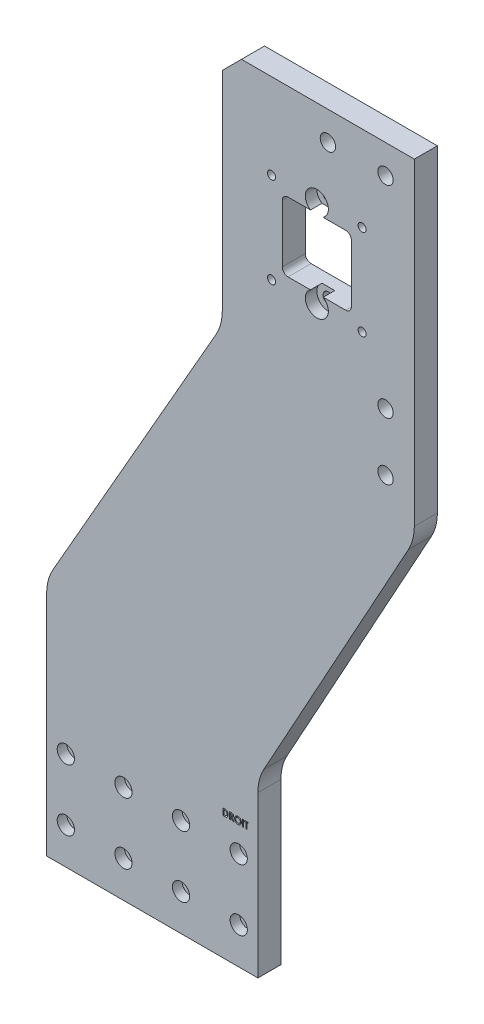
from build123d import *

# Parameters (mm, degrees)
ESQUISSE1_R             = 2.5
ESQUISSE1_R_2           = 2.1
ESQUISSE1_R_3           = 4
ESQUISSE1_R_4           = 2.75
BOSS_EXTRU_1_DEPTH      = 12
ESQUISSE2_R             = 4.5
ENL_V_MAT_EXTRU_1_DEPTH = 5
ESQUISSE3_W             = 0.628205128
ESQUISSE3_H             = 3.5
ENL_V_MAT_EXTRU_2_DEPTH = 1
ESQUISSE6_R             = 2.5
ENL_V_MAT_EXTRU_5_DEPTH = 10
ESQUISSE8_R             = 6
ENL_V_MAT_EXTRU_6_DEPTH = 6


with BuildPart() as part:
    # Esquisse1 → Boss.-Extru.1 (new body)
    with BuildSketch(Plane.XY):
        with BuildLine():
            Line((0, 0), (110, 0))
            Line((110, 0), (110, 83.574198108))
            ThreePointArc((110, 83.574198108), (110.787029848, 89.797708085), (113.098566114, 95.629371012))
            Line((113.098566114, 95.629371012), (188.36484852, 232.370628988))
            ThreePointArc((188.36484852, 232.370628988), (190.676384786, 238.202291915), (191.463414634, 244.425801892))
            Line((191.463414634, 244.425801892), (191.463414634, 410))
            Line((191.463414634, 410), (101.463414634, 410))
            Line((101.463414634, 410), (91.463414634, 400))
            Line((91.463414634, 400), (91.463414634, 291.641307553))
            ThreePointArc((91.463414634, 291.641307553), (90.625379122, 285.222626063), (88.167456868, 279.234271215))
            Line((88.167456868, 279.234271215), (3.295957766, 130.765728785))
            ThreePointArc((3.295957766, 130.765728785), (0.838035512, 124.777373937), (0, 118.358692447))
            Line((0, 118.358692447), (0, 0))
        make_face()
        with Locations((40, 51)):
            Circle(ESQUISSE1_R, mode=Mode.SUBTRACT)
        with Locations((40, 19)):
            Circle(ESQUISSE1_R, mode=Mode.SUBTRACT)
        with Locations((164.263414634, 318.43)):
            Circle(ESQUISSE1_R_2, mode=Mode.SUBTRACT)
        with Locations(Location((117.123414634, 318.43, 0), (0, 0, 180))):
            Circle(ESQUISSE1_R_2, mode=Mode.SUBTRACT)
        with Locations(Location((164.263414634, 365.57, 0), (0, 0, 180))):
            Circle(ESQUISSE1_R_2, mode=Mode.SUBTRACT)
        with Locations((117.123414634, 365.57)):
            Circle(ESQUISSE1_R_2, mode=Mode.SUBTRACT)
        with Locations((10, 51)):
            Circle(ESQUISSE1_R, mode=Mode.SUBTRACT)
        with Locations((10, 19)):
            Circle(ESQUISSE1_R, mode=Mode.SUBTRACT)
        with Locations(Location((100, 51, 0), (0, 0, 180))):
            Circle(ESQUISSE1_R, mode=Mode.SUBTRACT)
        with Locations(Location((100, 19, 0), (0, 0, 180))):
            Circle(ESQUISSE1_R, mode=Mode.SUBTRACT)
        with Locations(Location((70, 19, 0), (0, 0, 180))):
            Circle(ESQUISSE1_R, mode=Mode.SUBTRACT)
        with Locations(Location((70, 51, 0), (0, 0, 180))):
            Circle(ESQUISSE1_R, mode=Mode.SUBTRACT)
        with Locations((176.463414634, 395)):
            Circle(ESQUISSE1_R_3, mode=Mode.SUBTRACT)
        with Locations((146.463414634, 395)):
            Circle(ESQUISSE1_R_3, mode=Mode.SUBTRACT)
        with Locations((176.463414634, 290)):
            Circle(ESQUISSE1_R_3, mode=Mode.SUBTRACT)
        with Locations((176.463414634, 260)):
            Circle(ESQUISSE1_R_3, mode=Mode.SUBTRACT)
        with Locations((140.693414634, 319)):
            Circle(ESQUISSE1_R_4, mode=Mode.SUBTRACT)
        with Locations(Location((140.693414634, 365, 0), (0, 0, 180))):
            Circle(ESQUISSE1_R_4, mode=Mode.SUBTRACT)
        with BuildLine():
            Line((155.693414634, 360), (125.693414634, 360))
            ThreePointArc((125.693414634, 360), (123.572094291, 359.121320344), (122.693414634, 357))
            Line((122.693414634, 357), (122.693414634, 327))
            ThreePointArc((122.693414634, 327), (123.572094291, 324.878679656), (125.693414634, 324))
            Line((125.693414634, 324), (155.693414634, 324))
            ThreePointArc((155.693414634, 324), (157.814734978, 324.878679656), (158.693414634, 327))
            Line((158.693414634, 327), (158.693414634, 357))
            ThreePointArc((158.693414634, 357), (157.814734978, 359.121320344), (155.693414634, 360))
        make_face(mode=Mode.SUBTRACT)
    extrude(amount=BOSS_EXTRU_1_DEPTH)

    # Esquisse2 → Enlèv. mat.-Extru.1 (cut)
    with BuildSketch(Plane.XY.offset(12)):
        with Locations((10, 19)):
            Circle(ESQUISSE2_R)
        with Locations((40, 19)):
            Circle(ESQUISSE2_R)
        with Locations((70, 19)):
            Circle(ESQUISSE2_R)
        with Locations((100, 19)):
            Circle(ESQUISSE2_R)
        with Locations((40, 51)):
            Circle(ESQUISSE2_R)
        with Locations((70, 51)):
            Circle(ESQUISSE2_R)
        with Locations((100, 51)):
            Circle(ESQUISSE2_R)
        with Locations((10, 51)):
            Circle(ESQUISSE2_R)
    extrude(amount=-ENL_V_MAT_EXTRU_1_DEPTH, mode=Mode.SUBTRACT)

    # Esquisse3 → Enlèv. mat.-Extru.2 (cut)
    # profile 1 of 5: a face of its own
    with BuildSketch(Plane.XY.offset(12)):
        with BuildLine():
            Line((91.772253802, 67.649572565), (92.563820309, 67.649572565))
            add(Edge.make_bspline(
                [(92.563820309, 67.649572565), (92.625532023, 67.649141179), (92.744821463, 67.648307305), (92.917648263, 67.63891155), (93.078355194, 67.624461546), (93.227045852, 67.604582947), (93.363415396, 67.578278117), (93.48728798, 67.545283863), (93.599079351, 67.507197486), (93.700015278, 67.462381135), (93.792160072, 67.410129721), (93.879654494, 67.35192584), (93.962326751, 67.285637315), (94.041337018, 67.212542983), (94.115665651, 67.131305606), (94.186550488, 67.043270769), (94.252255946, 66.947161845), (94.314768159, 66.845283224), (94.371302137, 66.737203154), (94.420613186, 66.623841589), (94.46192135, 66.505928054), (94.495486372, 66.383336883), (94.522241569, 66.256475042), (94.540961641, 66.125086535), (94.552534576, 65.989293007), (94.553708554, 65.897259065), (94.554305085, 65.850494039)],
                knots=[0, 0, 0, 0, 1.44355588, 2.790409838, 4.047694926, 5.217575253, 6.298404546, 7.294384826, 8.214239204, 9.058592145, 9.873746385, 10.689560431, 11.514393297, 12.350027578, 13.205127629, 14.088021785, 14.991911688, 15.926770944, 16.882954281, 17.842803888, 18.816321264, 19.80318086, 20.814351908, 21.847355356, 22.906180909, 24, 24, 24, 24], degree=3))
            add(Edge.make_bspline(
                [(94.554305085, 65.850494039), (94.552743045, 65.784505544), (94.549668078, 65.654603328), (94.523766274, 65.463973322), (94.481874287, 65.281235449), (94.422970349, 65.107819154), (94.349945234, 64.945268735), (94.262708557, 64.796450702), (94.16253941, 64.662163832), (94.050604771, 64.543076766), (93.929406818, 64.440719819), (93.803457705, 64.353058584), (93.671530459, 64.283930385), (93.555284117, 64.24009277), (93.454484036, 64.212829566), (93.365982656, 64.19671675), (93.265454118, 64.181940326), (93.151961081, 64.170521423), (93.026001415, 64.160338568), (92.887073042, 64.154805601), (92.735625773, 64.150208527), (92.630431325, 64.149790107), (92.575739379, 64.149572565)],
                knots=[0, 0, 0, 0, 1.315458931, 2.589557908, 3.828601765, 5.048913369, 6.235739168, 7.376350998, 8.481830359, 9.569842114, 10.627874879, 11.640079404, 12.624025415, 13.590060155, 14.111227486, 14.704434459, 15.382649715, 16.137166398, 16.978595427, 17.902333227, 18.909396075, 20, 20, 20, 20], degree=3))
            Line((92.575739379, 64.149572565), (91.772253802, 64.149572565))
            Line((91.772253802, 64.149572565), (91.772253802, 67.649572565))
        make_face()
        with BuildLine():
            Line((92.400458931, 67.021367437), (92.400458931, 64.777777693))
            Line((92.400458931, 64.777777693), (92.728583931, 64.777777693))
            add(Edge.make_bspline(
                [(92.728583931, 64.777777693), (92.767625766, 64.777849234), (92.842716214, 64.777986831), (92.951129822, 64.784540684), (93.051384921, 64.791118946), (93.143205531, 64.803604707), (93.227259894, 64.817512966), (93.302393324, 64.836868214), (93.370154647, 64.857199261), (93.429716171, 64.883083204), (93.484269674, 64.912217305), (93.534779987, 64.946351282), (93.58353658, 64.984255775), (93.629627911, 65.027045611), (93.673228423, 65.074154171), (93.714080148, 65.125824186), (93.75272835, 65.181898007), (93.788181, 65.242672111), (93.820577823, 65.307504711), (93.849317434, 65.375767807), (93.873146813, 65.448029885), (93.892952334, 65.523614484), (93.907105624, 65.603179655), (93.918814772, 65.686136068), (93.92485118, 65.77281239), (93.925679639, 65.831789857), (93.926099956, 65.861711988)],
                knots=[0, 0, 0, 0, 1.50275155, 2.890291501, 4.180787663, 5.369391935, 6.45668281, 7.458360028, 8.354766181, 9.177074746, 9.954075863, 10.732690366, 11.5210699, 12.329727389, 13.151100085, 13.990027547, 14.863562427, 15.770965086, 16.696477834, 17.652329173, 18.619756807, 19.62365428, 20.657822005, 21.729286259, 22.847956731, 24, 24, 24, 24], degree=3))
            add(Edge.make_bspline(
                [(93.926099956, 65.861711988), (93.925262826, 65.907564825), (93.923630488, 65.996974304), (93.907888569, 66.127201161), (93.882263727, 66.249829256), (93.845699548, 66.364403484), (93.799609266, 66.471245856), (93.741916534, 66.569451194), (93.675104226, 66.66066921), (93.622270875, 66.714180625), (93.595871591, 66.740918719)],
                knots=[0, 0, 0, 0, 1.13821349, 2.219428113, 3.251817212, 4.244760574, 5.201143372, 6.134805572, 7.068016741, 8, 8, 8, 8], degree=3))
            add(Edge.make_bspline(
                [(93.595871591, 66.740918719), (93.569839397, 66.763703189), (93.516671588, 66.81023789), (93.423326387, 66.865998362), (93.320464811, 66.914989402), (93.205733694, 66.953833833), (93.080241861, 66.984553665), (92.943241882, 67.005740383), (92.79546742, 67.019354742), (92.693092716, 67.020682165), (92.640242585, 67.021367437)],
                knots=[0, 0, 0, 0, 0.813307809, 1.661089106, 2.549956539, 3.493439533, 4.508053171, 5.589449661, 6.755572447, 8, 8, 8, 8], degree=3))
            Line((92.640242585, 67.021367437), (92.400458931, 67.021367437))
        make_face(mode=Mode.SUBTRACT)
    # profile 2 of 5: a face of its own
    with BuildSketch(Plane.XY.offset(12)):
        with BuildLine():
            Line((95.182510213, 67.649572565), (95.914481367, 67.649572565))
            add(Edge.make_bspline(
                [(95.914481367, 67.649572565), (95.962864437, 67.649400833), (96.05591871, 67.649070543), (96.19009789, 67.643859454), (96.313359919, 67.636607795), (96.425887298, 67.625541571), (96.527631886, 67.610869095), (96.618695655, 67.593572674), (96.699075944, 67.573859694), (96.769450648, 67.549295766), (96.832960338, 67.521588028), (96.892160199, 67.489751329), (96.948356268, 67.45414018), (97.001172934, 67.413817556), (97.051069187, 67.369508851), (97.098139159, 67.321169464), (97.141717708, 67.268389497), (97.181534993, 67.211502452), (97.217825244, 67.151658585), (97.249898214, 67.08877573), (97.275980006, 67.022810157), (97.299026066, 66.95471521), (97.315625396, 66.883517459), (97.327169987, 66.809910026), (97.335622486, 66.733633805), (97.336108464, 66.681815127), (97.336356367, 66.65538186)],
                knots=[0, 0, 0, 0, 1.749336639, 3.364467119, 4.854658419, 6.213483162, 7.451590619, 8.570285859, 9.5643256, 10.440900261, 11.26203566, 12.067320669, 12.869050712, 13.665104639, 14.467235401, 15.27997916, 16.102287765, 16.939272006, 17.78853747, 18.631303466, 19.488103222, 20.351255419, 21.228522269, 22.127379805, 23.044756219, 24, 24, 24, 24], degree=3))
            add(Edge.make_bspline(
                [(97.336356367, 66.65538186), (97.335712404, 66.627791601), (97.334449712, 66.573692133), (97.327648163, 66.494224426), (97.315217069, 66.418195282), (97.296388369, 66.345827306), (97.274747223, 66.276219794), (97.245970051, 66.210657047), (97.213492167, 66.148185551), (97.174919134, 66.089688988), (97.132587114, 66.033868034), (97.083355866, 65.982861395), (97.030414818, 65.933927659), (96.970787961, 65.890131868), (96.907103701, 65.848512709), (96.838096701, 65.810794668), (96.764217323, 65.776029599), (96.712276461, 65.756642196), (96.685715341, 65.746728014)],
                knots=[0, 0, 0, 0, 1.099860209, 2.156625411, 3.176576793, 4.16617041, 5.135385252, 6.078461593, 7.016046972, 7.938469504, 8.868247731, 9.803980173, 10.76021508, 11.73834243, 12.748633912, 13.790971185, 14.870363756, 16, 16, 16, 16], degree=3))
            Line((96.685715341, 65.746728014), (97.493407649, 64.149572565))
            Line((97.493407649, 64.149572565), (96.795090341, 64.149572565))
            Line((96.795090341, 64.149572565), (96.023856367, 65.67521359))
            Line((96.023856367, 65.67521359), (95.810715341, 65.67521359))
            Line((95.810715341, 65.67521359), (95.810715341, 64.149572565))
            Line((95.810715341, 64.149572565), (95.182510213, 64.149572565))
            Line((95.182510213, 64.149572565), (95.182510213, 67.649572565))
        make_face()
        with BuildLine():
            Line((95.810715341, 66.303418719), (96.055406847, 66.303418719))
            add(Edge.make_bspline(
                [(96.055406847, 66.303418719), (96.085322418, 66.303755648), (96.142604308, 66.304400795), (96.224983189, 66.307393255), (96.299802859, 66.314603605), (96.367384619, 66.323713612), (96.428068535, 66.334232431), (96.481313327, 66.349306537), (96.527939417, 66.365458823), (96.567394283, 66.385531925), (96.601103614, 66.408359396), (96.630209463, 66.43429197), (96.654284174, 66.464305623), (96.674098889, 66.497584712), (96.689512583, 66.534423583), (96.700763399, 66.57441783), (96.707050942, 66.618023037), (96.707774345, 66.648116567), (96.708151238, 66.663795321)],
                knots=[0, 0, 0, 0, 1.688639943, 3.233382647, 4.650958383, 5.928841754, 7.082724185, 8.122798841, 9.049171256, 9.863274652, 10.613301712, 11.341792392, 12.054588806, 12.776240173, 13.521029143, 14.301969904, 15.115324896, 16, 16, 16, 16], degree=3))
            add(Edge.make_bspline(
                [(96.708151238, 66.663795321), (96.707438686, 66.682344432), (96.70603901, 66.718780724), (96.692149873, 66.771236207), (96.670041366, 66.819787346), (96.639736659, 66.864214775), (96.60157182, 66.903162925), (96.557774656, 66.93749603), (96.507399919, 66.964644081), (96.460756703, 66.982550646), (96.418322279, 66.993264328), (96.38002655, 67.00124807), (96.335679865, 67.006906376), (96.285248746, 67.012908018), (96.228861742, 67.016799779), (96.16621151, 67.019639988), (96.097477983, 67.020802058), (96.049564186, 67.021173551), (96.024557488, 67.021367437)],
                knots=[0, 0, 0, 0, 1.020303359, 2.004196876, 2.966617323, 3.9489082, 4.950758222, 5.960522915, 7.003732012, 8.091992268, 8.70421221, 9.413913587, 10.24622431, 11.166358409, 12.212345909, 13.359657661, 14.621978493, 16, 16, 16, 16], degree=3))
            Line((96.024557488, 67.021367437), (95.810715341, 67.021367437))
            Line((95.810715341, 67.021367437), (95.810715341, 66.303418719))
        make_face(mode=Mode.SUBTRACT)
    # profile 3 of 5: a face of its own
    with BuildSketch(Plane.XY.offset(12)):
        with BuildLine():
            add(Edge.make_bspline(
                [(99.65426502, 67.739316155), (99.71511681, 67.737740593), (99.835252025, 67.734630077), (100.011927574, 67.7087015), (100.182187133, 67.6664546), (100.34595371, 67.607728354), (100.502817254, 67.530932156), (100.653331074, 67.43824323), (100.796956037, 67.327912126), (100.932220389, 67.202512688), (101.057229046, 67.066146274), (101.16554912, 66.919323586), (101.257920506, 66.765848947), (101.334478157, 66.605311116), (101.392791059, 66.436598293), (101.433711633, 66.260570691), (101.460001075, 66.077278387), (101.463024766, 65.952481311), (101.464561495, 65.889055738)],
                knots=[0, 0, 0, 0, 1.014329547, 2.002516266, 2.970391464, 3.935626869, 4.897733899, 5.877609409, 6.878433252, 7.912639331, 8.949961323, 9.958554974, 10.949718813, 11.932905612, 12.9188844, 13.919928257, 14.942845884, 16, 16, 16, 16], degree=3))
            add(Edge.make_bspline(
                [(101.464561495, 65.889055738), (101.462924945, 65.826344824), (101.459700071, 65.702770957), (101.434784884, 65.521167764), (101.393175201, 65.347025784), (101.335851332, 65.179950843), (101.260682147, 65.020752194), (101.170112104, 64.868413377), (101.061751232, 64.724348131), (100.939551878, 64.588633768), (100.805020993, 64.465443863), (100.66253143, 64.356882972), (100.512741117, 64.264892569), (100.355869299, 64.189514792), (100.191579573, 64.131016875), (100.020277753, 64.089742343), (99.841974441, 64.064658977), (99.720719541, 64.061455168), (99.659172873, 64.059828975)],
                knots=[0, 0, 0, 0, 1.051557043, 2.072126891, 3.067553643, 4.050577992, 5.02905126, 6.015227836, 7.017913613, 8.04756643, 9.074058332, 10.072836633, 11.047628519, 12.017157415, 12.98668631, 13.966869689, 14.968021931, 16, 16, 16, 16], degree=3))
            add(Edge.make_bspline(
                [(99.659172873, 64.059828975), (99.594802438, 64.06128775), (99.468323331, 64.064154043), (99.283220592, 64.091411182), (99.105876174, 64.132469956), (98.937779872, 64.193747973), (98.777219769, 64.270350646), (98.625375547, 64.364691431), (98.482298236, 64.476614423), (98.348808551, 64.603253231), (98.227866572, 64.741823863), (98.121111553, 64.888211447), (98.031061327, 65.041297712), (97.957712598, 65.201154304), (97.899887406, 65.366787754), (97.859098304, 65.539206817), (97.835003207, 65.71799797), (97.831646901, 65.839436495), (97.82994611, 65.900974808)],
                knots=[0, 0, 0, 0, 1.067978421, 2.098431617, 3.099715153, 4.085208694, 5.062210972, 6.048429807, 7.046490867, 8.072918869, 9.098532598, 10.095778865, 11.076610158, 12.041847152, 13.011192615, 13.984257998, 14.978533688, 16, 16, 16, 16], degree=3))
            add(Edge.make_bspline(
                [(97.82994611, 65.900974808), (97.830479916, 65.942374564), (97.831540769, 66.024649859), (97.844319858, 66.146577647), (97.862718072, 66.266125568), (97.889928158, 66.382816983), (97.922981458, 66.497475095), (97.965806676, 66.609032639), (98.014553365, 66.718681356), (98.071509281, 66.825126158), (98.134838752, 66.927387662), (98.203936843, 67.024983484), (98.278977301, 67.116733548), (98.359718395, 67.203240797), (98.446438371, 67.283936613), (98.537996516, 67.359963358), (98.636168524, 67.42930149), (98.73880572, 67.493644385), (98.845329458, 67.551828549), (98.95530609, 67.60135317), (99.06646988, 67.644602178), (99.180305826, 67.678736207), (99.295593974, 67.706538016), (99.413565944, 67.72492383), (99.533155926, 67.737702565), (99.613799517, 67.738777015), (99.65426502, 67.739316155)],
                knots=[0, 0, 0, 0, 1.034744296, 2.056386356, 3.06226378, 4.057406941, 5.050368692, 6.043467995, 7.042652155, 8.049140477, 9.059438543, 10.048523776, 11.036952808, 12.020949711, 13.004946614, 13.997082645, 14.994316842, 16.007702937, 17.024872941, 18.026463647, 19.021641123, 20.005082605, 20.995858141, 21.984425357, 22.988620895, 24, 24, 24, 24], degree=3))
        make_face()
        with BuildLine():
            add(Edge.make_bspline(
                [(99.644449315, 67.111111026), (99.603496069, 67.110012159), (99.522670749, 67.107843434), (99.404114724, 67.091320684), (99.290296753, 67.064931975), (99.181847774, 67.026708251), (99.078297761, 66.978059153), (98.97946315, 66.919154665), (98.886712597, 66.847970012), (98.798809362, 66.76832678), (98.719403255, 66.679585917), (98.649245454, 66.58448499), (98.590534675, 66.483182816), (98.541364029, 66.376620469), (98.504349431, 66.263599683), (98.477985043, 66.145005762), (98.461323733, 66.020634363), (98.459223554, 65.935850542), (98.458151238, 65.892561347)],
                knots=[0, 0, 0, 0, 1.033739768, 2.040188636, 3.016340934, 3.979330865, 4.937572243, 5.900995986, 6.878200029, 7.884839167, 8.891893314, 9.879764717, 10.863503415, 11.843163062, 12.837761627, 13.859916423, 14.907309254, 16, 16, 16, 16], degree=3))
            add(Edge.make_bspline(
                [(98.458151238, 65.892561347), (98.459572966, 65.844587181), (98.462359316, 65.750565763), (98.481964413, 65.613409853), (98.515506783, 65.483879709), (98.563941313, 65.362608843), (98.624012838, 65.248250633), (98.698612137, 65.142206701), (98.786531056, 65.043842107), (98.854263078, 64.98641276), (98.88864002, 64.957264873)],
                knots=[0, 0, 0, 0, 1.078454662, 2.113592447, 3.107694534, 4.079536787, 5.043276885, 6.005368276, 6.987637804, 8, 8, 8, 8], degree=3))
            add(Edge.make_bspline(
                [(98.88864002, 64.957264873), (98.916801299, 64.935731533), (98.972489378, 64.893150004), (99.061379675, 64.838573039), (99.152919179, 64.791795136), (99.247798668, 64.753999143), (99.345817763, 64.724269451), (99.446963021, 64.703450236), (99.55109113, 64.690384378), (99.621507436, 64.688822761), (99.657069508, 64.688034103)],
                knots=[0, 0, 0, 0, 1.023928204, 2.024787132, 3.009472467, 3.9914905, 4.972207045, 5.96565515, 6.972602802, 8, 8, 8, 8], degree=3))
            add(Edge.make_bspline(
                [(99.657069508, 64.688034103), (99.697318562, 64.689142288), (99.776509842, 64.691322676), (99.892858882, 64.707642022), (100.004324797, 64.735260247), (100.111599576, 64.773148658), (100.214373886, 64.822408588), (100.312145441, 64.883140109), (100.405085662, 64.954597514), (100.492876909, 65.035286636), (100.573122258, 65.124377077), (100.643133654, 65.219985263), (100.703711143, 65.320004658), (100.751859284, 65.425850887), (100.790336245, 65.536524809), (100.816383325, 65.652516577), (100.833185384, 65.773348028), (100.835286155, 65.8555781), (100.836356367, 65.897469199)],
                knots=[0, 0, 0, 0, 1.026359118, 2.019393844, 2.989460624, 3.950973911, 4.916101784, 5.890408035, 6.881132271, 7.902007068, 8.92769091, 9.933912415, 10.920395702, 11.90457117, 12.894218921, 13.903490204, 14.931958862, 16, 16, 16, 16], degree=3))
            add(Edge.make_bspline(
                [(100.836356367, 65.897469199), (100.835249125, 65.939119413), (100.83306969, 66.021101507), (100.816721621, 66.141622301), (100.789278544, 66.257101999), (100.751276358, 66.367729192), (100.702749578, 66.473612336), (100.642741293, 66.574379082), (100.571462063, 66.669932014), (100.490552375, 66.759619975), (100.402487153, 66.842037466), (100.307940337, 66.913560867), (100.209557455, 66.975712428), (100.105081122, 67.024399451), (99.996648836, 67.063188299), (99.883598939, 67.091752964), (99.765503247, 67.107727361), (99.685160305, 67.109973084), (99.644449315, 67.111111026)],
                knots=[0, 0, 0, 0, 1.055025985, 2.07665775, 3.074803781, 4.057872707, 5.035505728, 6.020516407, 7.023567878, 8.050795229, 9.077271434, 10.074415901, 11.050397877, 12.019801805, 12.988065821, 13.964604439, 14.968634123, 16, 16, 16, 16], degree=3))
        make_face(mode=Mode.SUBTRACT)
    # profile 4 of 5: a face of its own
    with BuildSketch(Plane.XY.offset(12)):
        with Locations((102.317125597, 65.899572565)):
            Rectangle(ESQUISSE3_W, ESQUISSE3_H)
    # profile 5 of 5: a face of its own
    with BuildSketch(Plane.XY.offset(12)):
        Polygon((103.07994611, 67.649572565), (104.964561495, 67.649572565), (104.964561495, 67.021367437), (104.336356367, 67.021367437), (104.336356367, 64.149572565), (103.708151238, 64.149572565), (103.708151238, 67.021367437), (103.07994611, 67.021367437), align=None)
    extrude(amount=-ENL_V_MAT_EXTRU_2_DEPTH, mode=Mode.SUBTRACT)

    # Esquisse6 → Enlèv. mat.-Extru.5 (cut)
    with BuildSketch(Plane.XZ):
        with Locations(Location((15, 6, 0), (0, 0, 270))):
            Circle(ESQUISSE6_R)
        with Locations(Location((55, 6, 0), (0, 0, 270))):
            Circle(ESQUISSE6_R)
        with Locations(Location((95, 6, 0), (0, 0, 270))):
            Circle(ESQUISSE6_R)
    extrude(amount=-ENL_V_MAT_EXTRU_5_DEPTH, mode=Mode.SUBTRACT)

    # Esquisse8 → Enlèv. mat.-Extru.6 (cut)
    with BuildSketch(Plane.XY.offset(12)):
        with Locations((140.693414634, 365)):
            Circle(ESQUISSE8_R)
        with Locations((140.693414634, 319)):
            Circle(ESQUISSE8_R)
    extrude(amount=-ENL_V_MAT_EXTRU_6_DEPTH, mode=Mode.SUBTRACT)


solid = part.part
